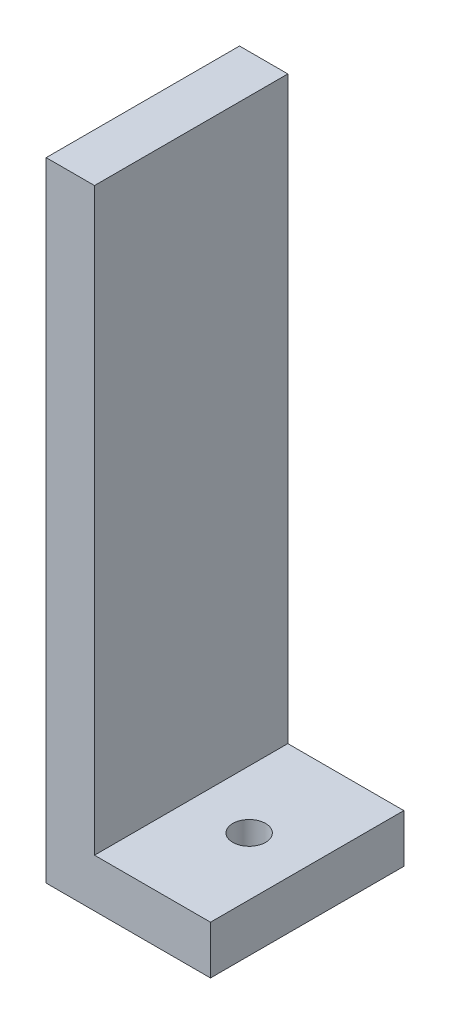
from build123d import *

# Parameters (mm, degrees)
Y_KSEKLIK_EKSTR_ZYON1_DEPTH = 20
IZIM2_R                     = 1.7
KES_EKSTR_ZYON1_DEPTH       = 20


with BuildPart() as part:
    # Çizim1 → Yükseklik-Ekstrüzyon1 (new body)
    with BuildSketch(Plane.XY):
        Polygon((0, 0), (12, 0), (12, -5), (-5, -5), (-5, 60), (0, 60), align=None)
    extrude(amount=Y_KSEKLIK_EKSTR_ZYON1_DEPTH)

    # Çizim2 → Kes-Ekstrüzyon1 (cut)
    with BuildSketch(Plane(origin=(0, 0, 0), x_dir=(1, 0, 0), z_dir=(0, 1, 0))):
        with Locations(Location((6, -10, 0), (0, 0, 270))):
            Circle(IZIM2_R)
    extrude(amount=-KES_EKSTR_ZYON1_DEPTH, mode=Mode.SUBTRACT)


solid = part.part
